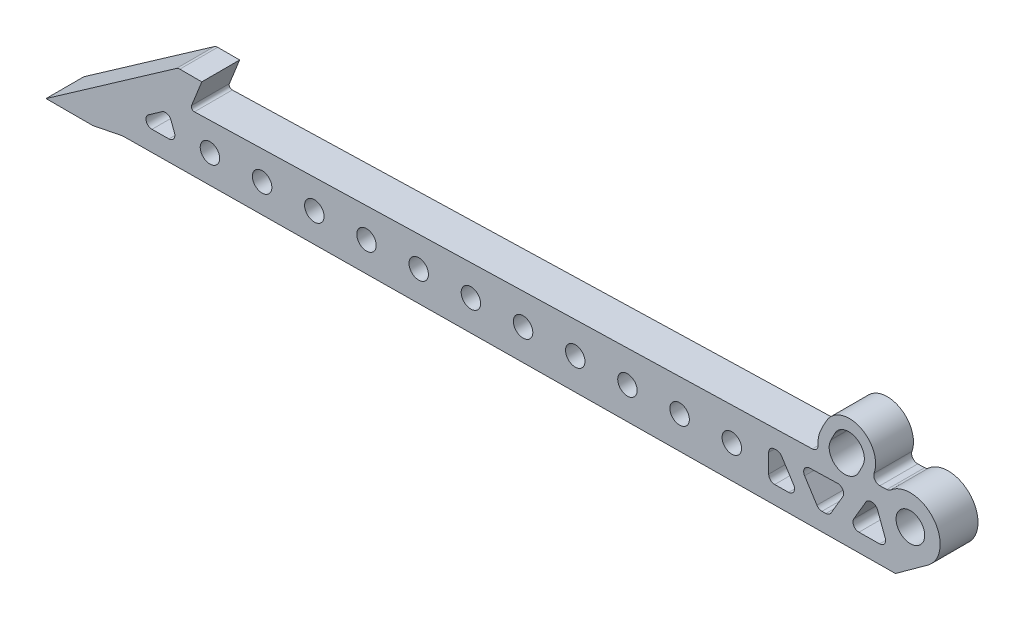
from build123d import *

# Parameters (mm, degrees)
SKETCH1_R           = 3.2639
SKETCH1_R_2         = 4.8025
BOSS_EXTRUDE1_DEPTH = 12.7
EXTRUDE_THIN1_DEPTH = 12.7
FILLET6_R           = 2
FILLET3_R           = 1
FILLET4_R           = 2
BOSS_EXTRUDE5_DEPTH = 12.7
CUT_EXTRUDE8_DEPTH  = 12.7
FILLET13_R          = 100
FILLET14_R          = 2
CUT_EXTRUDE9_DEPTH  = 12.7
FILLET16_R          = 2
BOSS_EXTRUDE6_DEPTH = 12.7
SKETCH18_R          = 3.2639
CUT_EXTRUDE10_DEPTH = 12.7
FILLET17_R          = 2


with BuildPart() as part:
    # Sketch1 → Boss-Extrude1 (new body)
    with BuildSketch(Plane.XY):
        with BuildLine():
            Line((-266.801436578, 66.762186411), (-251.101436578, 66.762186411))
            Line((-251.101436578, 66.762186411), (-241.101436578, 68.762186411))
            Line((-241.101436578, 68.762186411), (18.198563422, 71.262186411))
            Line((18.198563422, 71.262186411), (29.067448443, 79.140508783))
            ThreePointArc((29.067448443, 79.140508783), (30.773671377, 93.765412775), (16.057134994, 94.237186411))
            Line((16.057134994, 94.237186411), (-218.528848369, 87.762186411))
            Line((-218.528848369, 87.762186411), (-214.528848369, 97.762186411))
            Line((-214.528848369, 97.762186411), (-222.528848369, 97.762186411))
            Line((-222.528848369, 97.762186411), (-266.801436578, 66.762186411))
        make_face()
        with Locations((-211.801436578, 78.496276476)):
            Circle(SKETCH1_R, mode=Mode.SUBTRACT)
        with BuildLine():
            ThreePointArc((-197.554771535, 78.761405302), (-194.352166872, 82.085470554), (-191.028101621, 78.882865891))
            ThreePointArc((-191.028101621, 78.882865891), (-194.230706283, 75.55880064), (-197.554771535, 78.761405302))
        make_face(mode=Mode.SUBTRACT)
        with BuildLine():
            ThreePointArc((-180.044771535, 79.087264423), (-176.842166872, 82.411329675), (-173.518101621, 79.208725013))
            ThreePointArc((-173.518101621, 79.208725013), (-176.720706283, 75.884659761), (-180.044771535, 79.087264423))
        make_face(mode=Mode.SUBTRACT)
        with BuildLine():
            ThreePointArc((-162.534771535, 79.413123544), (-159.332166872, 82.737188796), (-156.008101621, 79.534584134))
            ThreePointArc((-156.008101621, 79.534584134), (-159.210706283, 76.210518882), (-162.534771535, 79.413123544))
        make_face(mode=Mode.SUBTRACT)
        with BuildLine():
            ThreePointArc((-145.024771535, 79.738982665), (-141.822166872, 83.063047917), (-138.498101621, 79.860443255))
            ThreePointArc((-138.498101621, 79.860443255), (-141.700706283, 76.536378003), (-145.024771535, 79.738982665))
        make_face(mode=Mode.SUBTRACT)
        with Locations((-124.251436578, 80.125572081)):
            Circle(SKETCH1_R, mode=Mode.SUBTRACT)
        with Locations((-106.744467891, 80.45137479)):
            Circle(SKETCH1_R, mode=Mode.SUBTRACT)
        with Locations((-89.237499204, 80.777177499)):
            Circle(SKETCH1_R, mode=Mode.SUBTRACT)
        with Locations((-71.727499204, 81.10303662)):
            Circle(SKETCH1_R, mode=Mode.SUBTRACT)
        with BuildLine():
            ThreePointArc((-56.754762895, 76.539814612), (-61.641816892, 81.290680691), (-56.935012167, 86.220185184))
            Line((-56.935012167, 86.220185184), (11.656299, 88.113430183))
            Line((11.656299, 88.113430183), (15.733532107, 77.238699061))
            Line((15.733532107, 77.238699061), (-56.754762895, 76.539814612))
        make_face(mode=Mode.SUBTRACT)
        with Locations((23.198563422, 87.237186411)):
            Circle(SKETCH1_R_2, mode=Mode.SUBTRACT)
    extrude(amount=BOSS_EXTRUDE1_DEPTH)

    # Sketch3 → Extrude-Thin1 (add)
    with BuildSketch(Plane.XY.offset(12.7)):
        Polygon((4.238515695, 91.06458037), (3.224088624, 89.340939538), (-3.171442721, 78.474116994), (-4.185869793, 76.750476162), (0.554142495, 73.960801716), (1.568569566, 75.684442548), (7.964100911, 86.551265092), (8.978527982, 88.274905924), align=None)
        Polygon((-7.406763076, 76.778305642), (-8.483669151, 78.463616684), (-15.08355213, 88.792145717), (-16.160458205, 90.477456759), (-20.795063569, 87.515965054), (-19.718157494, 85.830654012), (-13.118274515, 75.502124979), (-12.04136844, 73.816813937), align=None)
        Polygon((-55.789995158, 86.920345113), (-54.713089083, 85.235034072), (-48.113206103, 74.906505038), (-47.036300029, 73.221193997), (-42.401694665, 76.182685702), (-43.478600739, 77.867996743), (-50.078483719, 88.196525777), (-51.155389794, 89.881836818), align=None)
        Polygon((-30.756415894, 90.46896043), (-31.770842965, 88.745319598), (-38.16637431, 77.878497054), (-39.180801381, 76.154856222), (-34.440789094, 73.365181776), (-33.426362022, 75.088822608), (-27.030830678, 85.955645152), (-26.016403606, 87.679285984), align=None)
    extrude(amount=-EXTRUDE_THIN1_DEPTH)

    # Fillet6
    fillet6_edges = [part.edges().sort_by_distance(p)[0] for p in [
        (-7.55746183, 77.014142621, 6.35),
        (-14.193924314, 87.399916982, 6.35),
        (-38.852657232, 76.712414937, 6.35),
        (-32.865984778, 86.884534137, 6.35),
        (-32.434398171, 76.774295568, 6.35),
        (-26.378761772, 87.063593296, 6.35),
        (-49.203405679, 76.61261983, 6.35),
        (-55.370195509, 86.263376972, 6.35),
        (-42.716385675, 76.675163409, 6.35),
        (-48.956334512, 86.440411206, 6.35),
        (15.733532107, 77.238699061, 6.35),
        (11.656299, 88.113430183, 6.35),
        (-4.010566108, 77.048339456, 6.35),
        (2.350483264, 87.856572736, 6.35),
        (2.407692953, 77.110220087, 6.35),
        (8.83770627, 88.035631895, 6.35),
    ]]
    fillet(fillet6_edges, radius=FILLET6_R)

    # Fillet3
    fillet3_edges = [part.edges().sort_by_distance(p)[0] for p in [
        (-218.528848369, 87.762186411, 6.35),
    ]]
    fillet(fillet3_edges, radius=FILLET3_R)

    # Fillet4
    fillet4_edges = [part.edges().sort_by_distance(p)[0] for p in [
        (-222.528848369, 97.762186411, 6.35),
    ]]
    fillet(fillet4_edges, radius=FILLET4_R)

    # Sketch15 → Boss-Extrude5 (add)
    with BuildSketch(Plane(origin=(0, 0, 0), x_dir=(-1, 0, 0), z_dir=(0, 0, -1))):
        with BuildLine():
            ThreePointArc((-10.240564525, 95.177858348), (-9.91771052, 94.625214052), (-9.618412164, 94.059465945))
            Line((-9.618412164, 94.059465945), (-5.586658581, 93.948182209))
            ThreePointArc((-5.586658581, 93.948182209), (-6.060393003, 94.847345318), (-6.352002714, 95.820937828))
            ThreePointArc((-6.352002714, 95.820937828), (-4.888389862, 104.071201116), (2.646503395, 100.405905698))
            ThreePointArc((2.646503395, 100.405905698), (3.686135654, 98.752465403), (4.04944042, 96.833426662))
            ThreePointArc((4.04944042, 96.833426662), (3.785365476, 95.18933076), (3.019706577, 93.710630871))
            Line((3.019706577, 93.710630871), (7.309930071, 93.592212896))
            ThreePointArc((7.309930071, 93.592212896), (7.772330748, 96.70964865), (7.106994943, 99.790159701))
            ThreePointArc((7.106994943, 99.790159701), (6.028678087, 102.129209778), (4.770165569, 104.37644558))
            ThreePointArc((4.770165569, 104.37644558), (-7.334493094, 107.282517011), (-10.240564525, 95.177858348))
        make_face()
    extrude(amount=-BOSS_EXTRUDE5_DEPTH)

    # Sketch15<3> → Cut-Extrude8 (cut)
    with BuildSketch(Plane(origin=(0, 0, 0), x_dir=(-1, 0, 0), z_dir=(0, 0, -1))):
        with BuildLine():
            Line((3.019706577, 93.710630871), (-5.586658581, 93.948182209))
            ThreePointArc((-5.586658581, 93.948182209), (-1.345413965, 91.585425404), (3.019706577, 93.710630871))
        make_face()
    extrude(amount=-CUT_EXTRUDE8_DEPTH, mode=Mode.SUBTRACT)

    # Fillet13
    fillet13_edges = [part.edges().sort_by_distance(p)[0] for p in [
        (6.352002714, 95.820937828, 6.35),
        (-2.646503395, 100.405905698, 6.35),
    ]]
    fillet(fillet13_edges, radius=FILLET13_R)

    # Fillet14
    fillet14_edges = [part.edges().sort_by_distance(p)[0] for p in [
        (16.057134994, 94.237186411, 6.35),
        (-7.309930071, 93.592212896, 6.35),
        (9.618412164, 94.059465945, 6.35),
    ]]
    fillet(fillet14_edges, radius=FILLET14_R)

    # Sketch17 → Cut-Extrude9 (cut)
    with BuildSketch(Plane(origin=(0, 0, 0), x_dir=(-1, 0, 0), z_dir=(0, 0, -1))):
        Polygon((225.771163147, 83.894534568), (237.695045428, 75.54534231), (222.695045428, 75.689962442), align=None)
    extrude(amount=-CUT_EXTRUDE9_DEPTH, mode=Mode.SUBTRACT)

    # Fillet16
    fillet16_edges = [part.edges().sort_by_distance(p)[0] for p in [
        (-237.695045428, 75.54534231, 6.35),
        (-225.771163147, 83.894534568, 6.35),
        (-222.695045428, 75.689962442, 6.35),
    ]]
    fillet(fillet16_edges, radius=FILLET16_R)

    # Sketch20 → Boss-Extrude6 (add)
    with BuildSketch(Plane(origin=(0, 0, 0), x_dir=(-1, 0, 0), z_dir=(0, 0, -1))):
        Polygon((24.344481835, 87.119743124), (24.344481835, 76.852293218), (33.994868443, 72.80053303), (65.802348689, 76.852293218), (61.329456715, 89.562181047), align=None)
    extrude(amount=-BOSS_EXTRUDE6_DEPTH)

    # Sketch18 → Cut-Extrude10 (cut)
    with BuildSketch(Plane(origin=(0, 0, 0), x_dir=(-1, 0, 0), z_dir=(0, 0, -1))):
        with Locations((54.220530518, 81.428839328)):
            Circle(SKETCH18_R)
        with Locations((36.713561831, 81.754642037)):
            Circle(SKETCH18_R)
    extrude(amount=-CUT_EXTRUDE10_DEPTH, mode=Mode.SUBTRACT)

    # Fillet17
    fillet17_edges = [part.edges().sort_by_distance(p)[0] for p in [
        (-14.044481835, 76.951599042, 6.35),
        (-20.607785311, 87.222882748, 6.35),
        (-24.344481835, 76.852293218, 6.35),
        (-24.344481835, 87.119743124, 6.35),
    ]]
    fillet(fillet17_edges, radius=FILLET17_R)


solid = part.part
